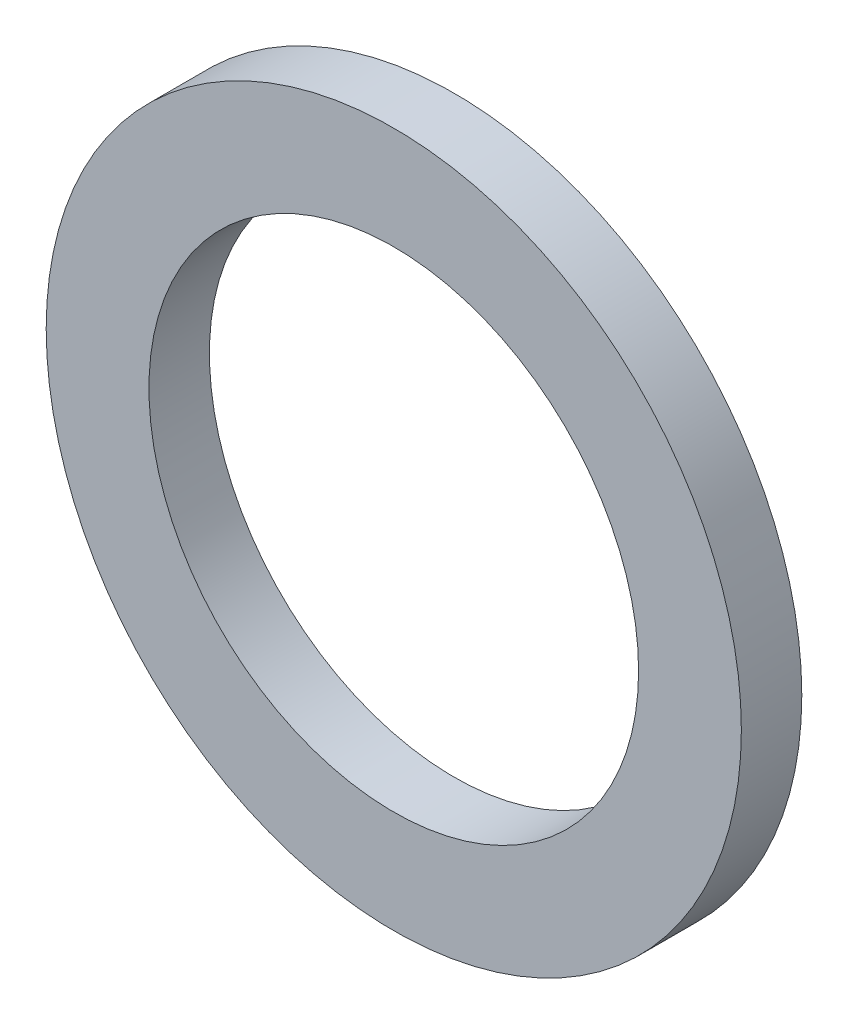
from build123d import *

# Parameters (mm, degrees)
SKETCH1_R           = 5.75
SKETCH1_R_2         = 4.05
BOSS_EXTRUDE1_DEPTH = 1


with BuildPart() as part:
    # Sketch1 → Boss-Extrude1 (new body)
    with BuildSketch(Plane.XY):
        Circle(SKETCH1_R)
        Circle(SKETCH1_R_2, mode=Mode.SUBTRACT)
    extrude(amount=BOSS_EXTRUDE1_DEPTH)


solid = part.part
